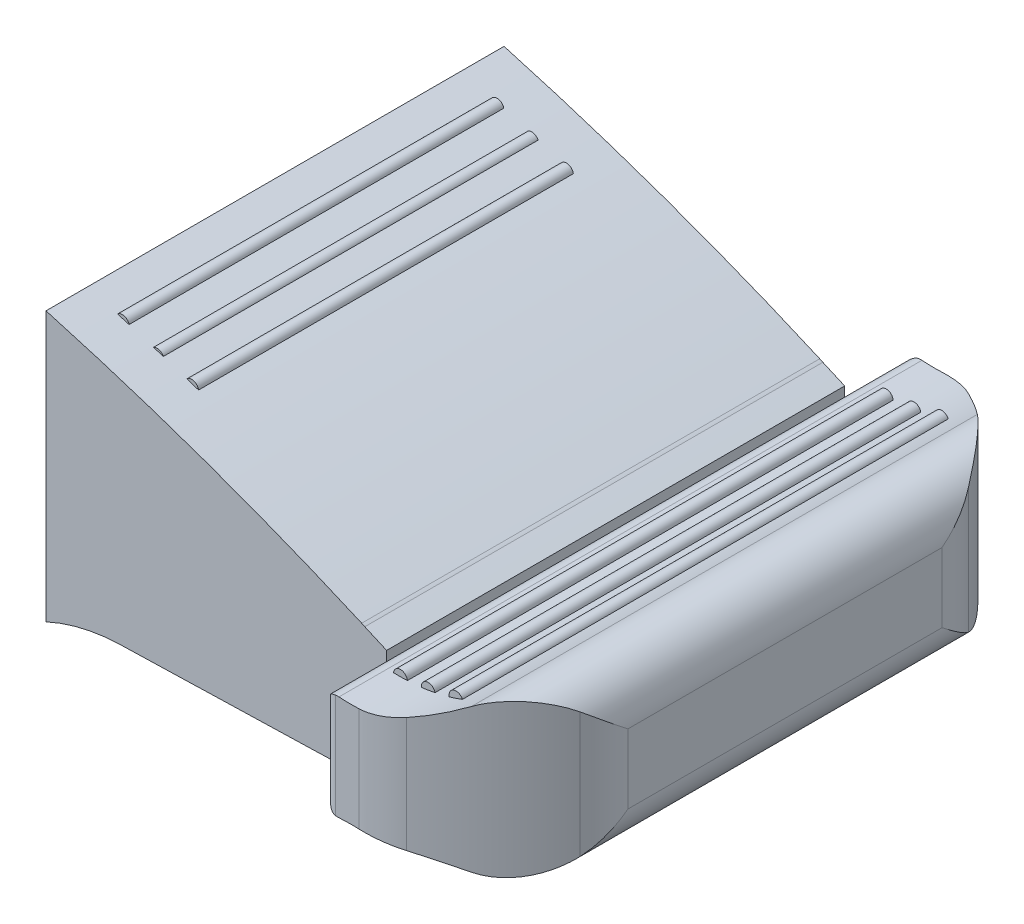
from build123d import *

# Parameters (mm, degrees)
EXT_PEDAL_STEM_DEPTH     = 20.955
EXT_FOOT_SIDE_DEPTH      = 26.67
CUT_FOOT_PLAN_DEPTH      = 126.067228803
CUT_FOOT_PLAN_DEPTH_BACK = 126.067228803
SK_RIBS_STEM_R           = 0.635
EXT_RIBS_STEM_DEPTH      = 17.145
SK_RIBS_FOOT_R           = 0.635
EXT_RIBS_FOOT_DEPTH      = 22.225


with BuildPart() as part:
    # Sk_pedal_stem → Ext_pedal_stem (new, symmetric)
    with BuildSketch(Plane.XY):
        with BuildLine():
            Line((62.5221, 30.214062), (62.5221, 54.861968))
            ThreePointArc((62.5221, 54.861968), (77.145265739, 50.212536002), (91.40698, 44.550584))
            ThreePointArc((91.40698, 44.550584), (91.550950572, 44.483878693), (91.691968, 44.411138))
            ThreePointArc((91.691968, 44.411138), (92.690956134, 43.975699122), (93.6879, 43.5356))
            Line((93.6879, 43.5356), (93.6879, 36.191698))
            ThreePointArc((93.6879, 36.191698), (92.609350592, 33.535520735), (89.984326, 32.383222))
            Line((89.984326, 32.383222), (69.311266, 31.805626))
            ThreePointArc((69.311266, 31.805626), (65.835901534, 31.354435095), (62.5221, 30.214062))
        make_face()
    extrude(amount=EXT_PEDAL_STEM_DEPTH, both=True)

    # Sk_foot_side → Ext_foot_side (add, symmetric)
    with BuildSketch(Plane.XY):
        with BuildLine():
            Line((93.6879, 35.071812), (93.6879, 42.118788))
            ThreePointArc((93.6879, 42.118788), (94.090678285, 43.046595361), (95.043498, 43.385994))
            ThreePointArc((95.043498, 43.385994), (99.464687923, 43.686511406), (103.64216, 45.16501))
            ThreePointArc((103.64216, 45.16501), (107.36259935, 45.018864691), (109.1819, 41.7703))
            Line((109.1819, 41.7703), (109.1819, 35.4203))
            ThreePointArc((109.1819, 35.4203), (107.362602336, 32.171730436), (103.64216, 32.02559))
            ThreePointArc((103.64216, 32.02559), (99.464578688, 33.503560617), (95.043498, 33.804606))
            ThreePointArc((95.043498, 33.804606), (94.090614283, 34.143936173), (93.6879, 35.071812))
        make_face()
    extrude(amount=EXT_FOOT_SIDE_DEPTH, both=True)

    # Sk_foot_plan_trim → Cut_foot_plan (cut, two sides: drawn at the far end of the back side and taken through both)
    with BuildSketch(Plane(origin=(0, 0, 0), x_dir=(1, 0, 0), z_dir=(0, 1, 0)).offset(-CUT_FOOT_PLAN_DEPTH_BACK)):
        with BuildLine():
            Line((94.7039, -26.67), (96.87306, -26.67))
            ThreePointArc((96.87306, -26.67), (98.633684187, -26.421041098), (100.25634, -25.693878))
            ThreePointArc((100.25634, -25.693878), (104.672679306, -22.171677589), (108.200952, -17.760188))
            ThreePointArc((108.200952, -17.760188), (108.932068295, -16.134088594), (109.1819, -14.36878))
            Line((109.1819, -14.36878), (109.1819, 14.36878))
            ThreePointArc((109.1819, 14.36878), (108.931624488, 16.133960225), (108.200952, 17.760188))
            ThreePointArc((108.200952, 17.760188), (104.672363352, 22.1713612), (100.25634, 25.693878))
            ThreePointArc((100.25634, 25.693878), (98.633741991, 26.421241452), (96.87306, 26.67))
            Line((96.87306, 26.67), (94.7039, 26.67))
            ThreePointArc((94.7039, 26.67), (93.98547951, 26.37242049), (93.6879, 25.654))
            Line((93.6879, 25.654), (93.6879, 40.64))
            Line((93.6879, 40.64), (119.38, 40.64))
            Line((119.38, 40.64), (119.38, -40.64))
            Line((119.38, -40.64), (93.6879, -40.64))
            Line((93.6879, -40.64), (93.6879, -25.654))
            ThreePointArc((93.6879, -25.654), (93.98547951, -26.37242049), (94.7039, -26.67))
        make_face()
    extrude(amount=CUT_FOOT_PLAN_DEPTH + CUT_FOOT_PLAN_DEPTH_BACK, mode=Mode.SUBTRACT)

    # Sk_ribs_stem → Ext_ribs_stem (add, symmetric)
    with BuildSketch(Plane.XY):
        with Locations((65.6971, 53.61178)):
            Circle(SK_RIBS_STEM_R)
        with Locations((68.8721, 52.53228)):
            Circle(SK_RIBS_STEM_R)
        with Locations((72.0471, 51.64836)):
            Circle(SK_RIBS_STEM_R)
    extrude(amount=EXT_RIBS_STEM_DEPTH, both=True)

    # Sk_ribs_foot → Ext_ribs_foot (add, symmetric)
    with BuildSketch(Plane.XY):
        with Locations((96.2279, 43.2943)):
            Circle(SK_RIBS_FOOT_R)
        with Locations((98.7679, 43.5356)):
            Circle(SK_RIBS_FOOT_R)
        with Locations((101.3079, 44.13504)):
            Circle(SK_RIBS_FOOT_R)
    extrude(amount=EXT_RIBS_FOOT_DEPTH, both=True)


solid = part.part
